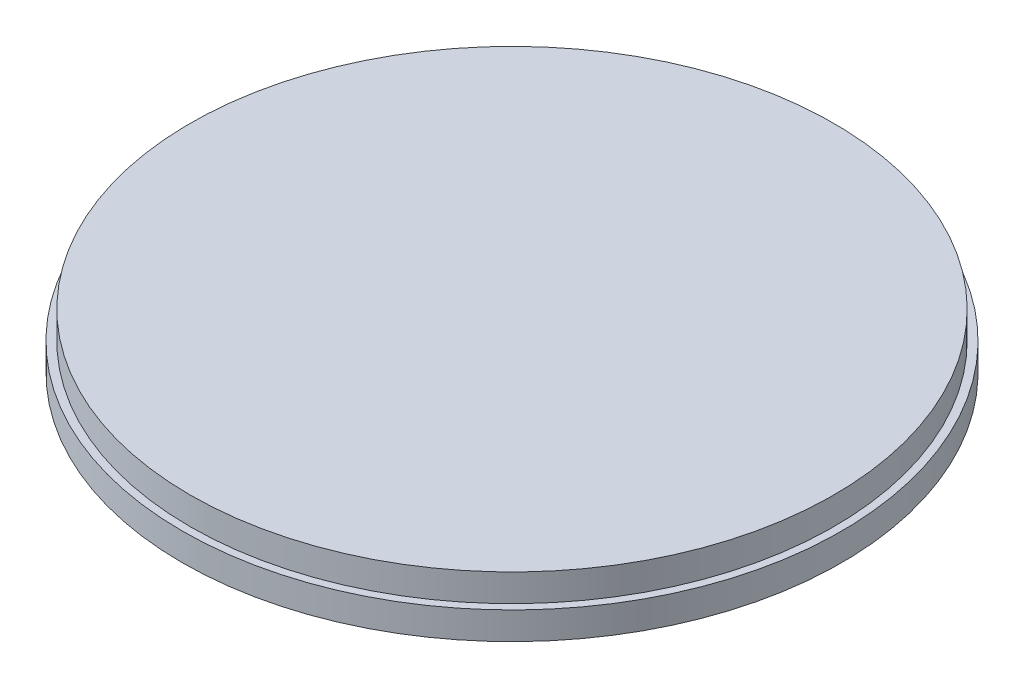
from build123d import *

# Parameters (mm, degrees)
SKETCH1_R           = 76.2
BOSS_EXTRUDE1_DEPTH = 6.35
SKETCH2_R           = 74.422
BOSS_EXTRUDE2_DEPTH = 6.35


with BuildPart() as part:
    # Sketch1 → Boss-Extrude1 (new body)
    with BuildSketch(Plane(origin=(0, 0, 0), x_dir=(1, 0, 0), z_dir=(0, 1, 0))):
        with Locations(Location((0, 0, 0), (0, 0, 270))):
            Circle(SKETCH1_R)
    extrude(amount=BOSS_EXTRUDE1_DEPTH)

    # Sketch2 → Boss-Extrude2 (add)
    with BuildSketch(Plane(origin=(0, 6.35, 0), x_dir=(1, 0, 0), z_dir=(0, 1, 0))):
        with Locations(Location((0, 0, 0), (0, 0, 270))):
            Circle(SKETCH2_R)
    extrude(amount=BOSS_EXTRUDE2_DEPTH)


solid = part.part
